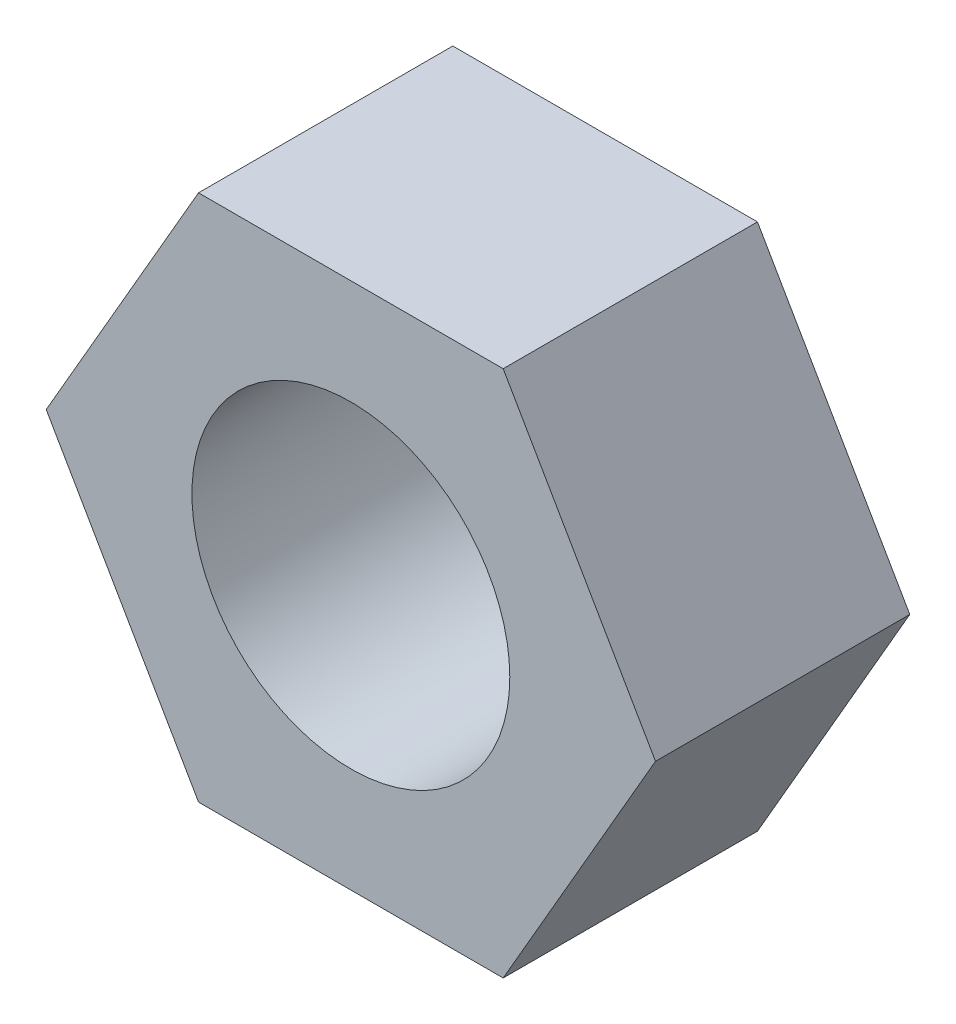
from build123d import *

# Parameters (mm, degrees)
EXTRUDE_485_DEPTH         = 4
CUT_EXTRUDE_M5_DEPTH      = 8.495721002
CUT_EXTRUDE_M5_DEPTH_BACK = 8.495721002
SKETCH_527_R              = 2.5


with BuildPart() as part:
    # Sketch 341 → Extrude 485 (new body)
    with BuildSketch(Plane.XY):
        Polygon((4.792007234, 0), (2.396003617, 4.15), (-2.396003617, 4.15), (-4.792007234, 0), (-2.396003617, -4.15), (2.396003617, -4.15), align=None)
    extrude(amount=EXTRUDE_485_DEPTH)

    # Sketch 527 → Отверстие_под_M5 (cut, two sides: drawn at the far end of the back side and taken through both)
    with BuildSketch(Plane.XY.offset(-CUT_EXTRUDE_M5_DEPTH_BACK)):
        Circle(SKETCH_527_R)
    extrude(amount=CUT_EXTRUDE_M5_DEPTH + CUT_EXTRUDE_M5_DEPTH_BACK, mode=Mode.SUBTRACT)


solid = part.part
